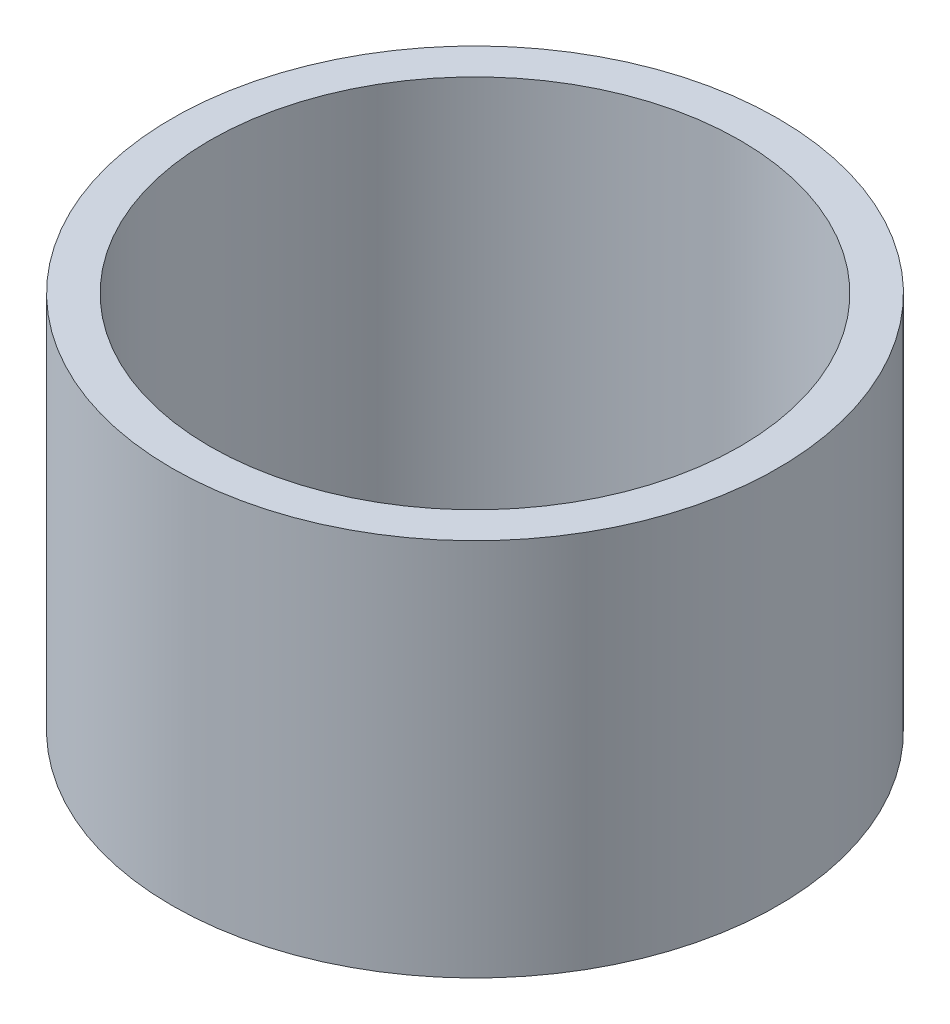
from build123d import *

# Parameters (mm, degrees)
SKETCH1_R           = 8
SKETCH1_R_2         = 7
BOSS_EXTRUDE1_DEPTH = 10


with BuildPart() as part:
    # Sketch1 → Boss-Extrude1 (new body)
    with BuildSketch(Plane(origin=(0, 0, 0), x_dir=(1, 0, 0), z_dir=(0, 1, 0))):
        with Locations(Location((0, 0, 0), (0, 0, 270))):
            Circle(SKETCH1_R)
        with Locations(Location((0, 0, 0), (0, 0, 270))):
            Circle(SKETCH1_R_2, mode=Mode.SUBTRACT)
    extrude(amount=BOSS_EXTRUDE1_DEPTH)


solid = part.part
